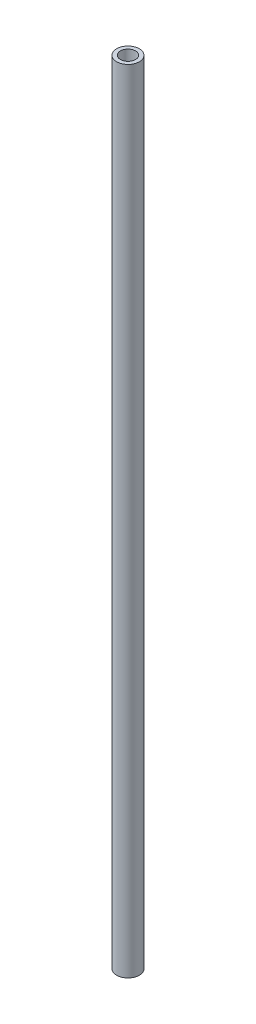
from build123d import *

# Parameters (mm, degrees)
SKETCH_1_R      = 6
SKETCH_1_R_2    = 4
EXTRUDE_1_DEPTH = 420


with BuildPart() as part:
    # 草图1 → 凸台-拉伸1 (new body)
    with BuildSketch(Plane(origin=(0, 0, 0), x_dir=(1, 0, 0), z_dir=(0, 1, 0))):
        with Locations(Location((0, 0, 0), (0, 0, 270))):
            Circle(SKETCH_1_R)
        with Locations(Location((0, 0, 0), (0, 0, 270))):
            Circle(SKETCH_1_R_2, mode=Mode.SUBTRACT)
    extrude(amount=EXTRUDE_1_DEPTH)


solid = part.part
